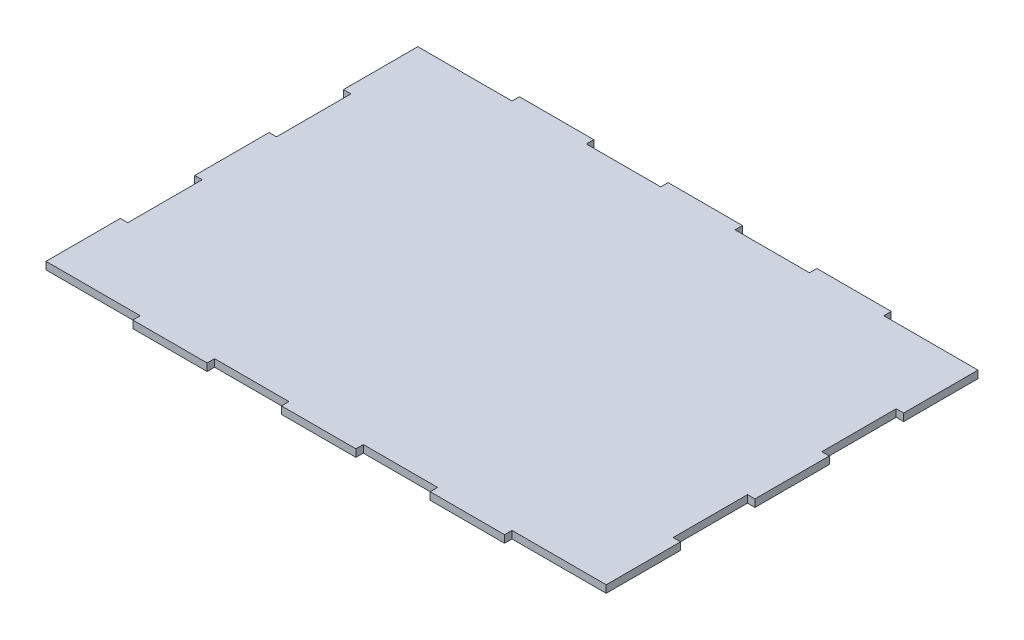
from build123d import *

# Parameters (mm, degrees)
SKETCH1_W           = 220
SKETCH1_H           = 150
SKETCH1_W_2         = 3
SKETCH1_H_2         = 30
SKETCH1_W_3         = 30
SKETCH1_H_3         = 3
BOSS_EXTRUDE1_DEPTH = 3


with BuildPart() as part:
    # Sketch1 → Boss-Extrude1 (new body)
    with BuildSketch(Plane(origin=(0, 0, 0), x_dir=(1, 0, 0), z_dir=(0, 1, 0))):
        with Locations((110, 75)):
            Rectangle(SKETCH1_W, SKETCH1_H)
        with Locations((-1.5, 15)):
            Rectangle(SKETCH1_W_2, SKETCH1_H_2)
        with Locations((-1.5, 75)):
            Rectangle(SKETCH1_W_2, SKETCH1_H_2)
        with Locations((-1.5, 135)):
            Rectangle(SKETCH1_W_2, SKETCH1_H_2)
        with Locations((50, 151.5)):
            Rectangle(SKETCH1_W_3, SKETCH1_H_3)
        with Locations((110, 151.5)):
            Rectangle(SKETCH1_W_3, SKETCH1_H_3)
        with Locations((170, 151.5)):
            Rectangle(SKETCH1_W_3, SKETCH1_H_3)
        with Locations((221.5, 135)):
            Rectangle(SKETCH1_W_2, SKETCH1_H_2)
        with Locations((221.5, 75)):
            Rectangle(SKETCH1_W_2, SKETCH1_H_2)
        with Locations((221.5, 15)):
            Rectangle(SKETCH1_W_2, SKETCH1_H_2)
        with Locations((170, -1.5)):
            Rectangle(SKETCH1_W_3, SKETCH1_H_3)
        with Locations((110, -1.5)):
            Rectangle(SKETCH1_W_3, SKETCH1_H_3)
        with Locations((50, -1.5)):
            Rectangle(SKETCH1_W_3, SKETCH1_H_3)
    extrude(amount=BOSS_EXTRUDE1_DEPTH)


solid = part.part
